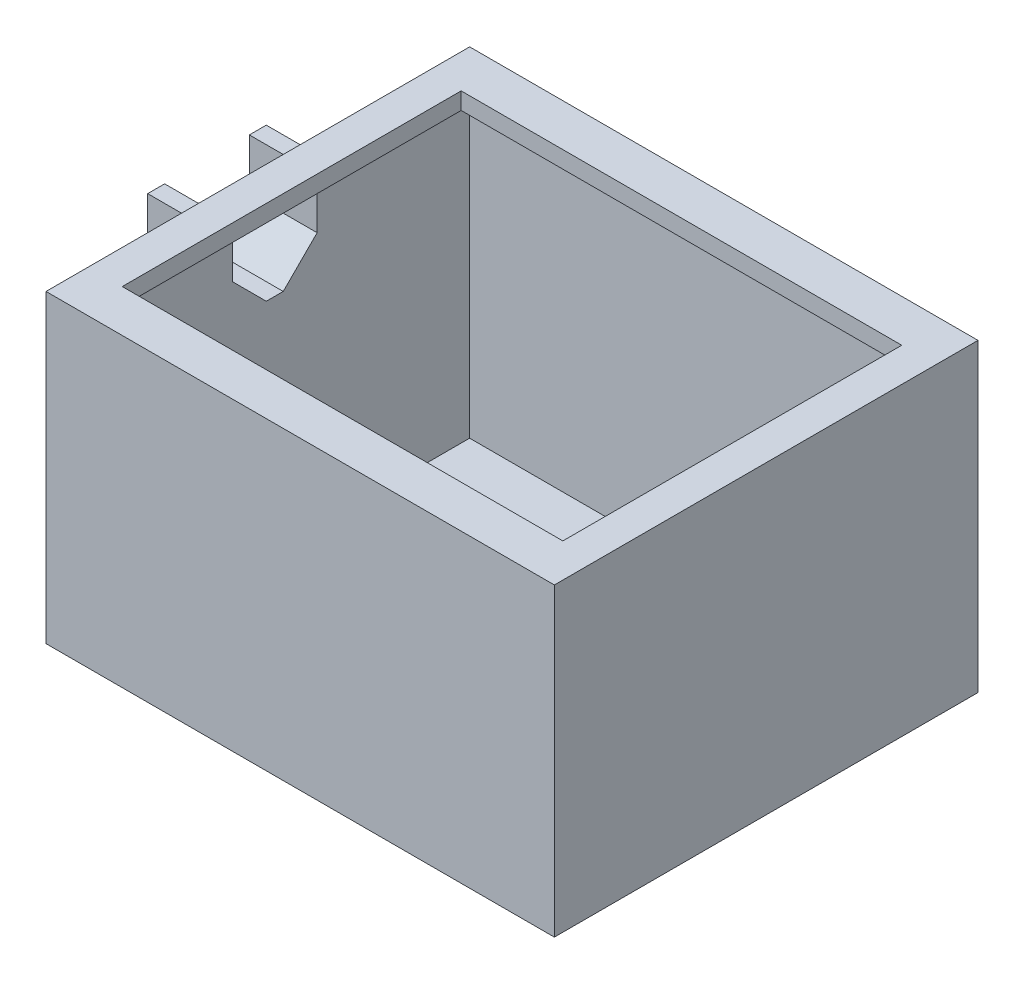
from build123d import *

# Parameters (mm, degrees)
SKETCH1_W           = 60
SKETCH1_H           = 50
BOSS_EXTRUDE1_DEPTH = 40
SHELL1_T            = 2
SKETCH2_W           = 52
SKETCH2_H           = 40
CUT_EXTRUDE1_DEPTH  = 10
CHAMFER1_SIZE       = 4
SKETCH3_W           = 10
SKETCH3_H           = 10
CUT_EXTRUDE2_DEPTH  = 5
BOSS_EXTRUDE2_DEPTH = 6
CHAMFER3_SIZE       = 5
CHAMFER4_SIZE       = 4


with BuildPart() as part:
    # Sketch1 → Boss-Extrude1 (new body)
    with BuildSketch(Plane(origin=(0, 0, 0), x_dir=(1, 0, 0), z_dir=(0, 1, 0))):
        Rectangle(SKETCH1_W, SKETCH1_H)
    extrude(amount=BOSS_EXTRUDE1_DEPTH)

    # Shell1 (no face opened: a closed hollow body)
    add(offset(amount=-SHELL1_T, mode=Mode.PRIVATE), mode=Mode.SUBTRACT)

    # Sketch2 → Cut-Extrude1 (cut)
    with BuildSketch(Plane(origin=(0, 40, 0), x_dir=(1, 0, 0), z_dir=(0, 1, 0))):
        Rectangle(SKETCH2_W, SKETCH2_H)
    extrude(amount=-CUT_EXTRUDE1_DEPTH, mode=Mode.SUBTRACT)

    # Chamfer1
    chamfer1_edges = [part.edges().sort_by_distance(p)[0] for p in [
        (0, 0, 25),
        (-30, 0, 0),
        (0, 0, -25),
        (30, 0, 0),
    ]]
    chamfer(chamfer1_edges, length=CHAMFER1_SIZE)

    # Sketch3 → Cut-Extrude2 (cut)
    with BuildSketch(Plane(origin=(-30, 0, 0), x_dir=(0, 0, -1), z_dir=(1, 0, 0))):
        with Locations((0, 33)):
            Rectangle(SKETCH3_W, SKETCH3_H)
    extrude(amount=CUT_EXTRUDE2_DEPTH, mode=Mode.SUBTRACT)

    # Sketch4 → Boss-Extrude2 (add)
    with BuildSketch(Plane(origin=(-30, 0, 0), x_dir=(0, 0, -1), z_dir=(1, 0, 0))):
        Polygon((-5, 38), (-7, 38), (-7, 26), (7, 26), (7, 38), (5, 38), (5, 28), (-5, 28), align=None)
    extrude(amount=-BOSS_EXTRUDE2_DEPTH)

    # Chamfer3
    chamfer3_edges = [part.edges().sort_by_distance(p)[0] for p in [
        (-30, 26, 0),
    ]]
    chamfer(chamfer3_edges, length=CHAMFER3_SIZE)

    # Chamfer4
    chamfer4_edges = [part.edges().sort_by_distance(p)[0] for p in [
        (-32, 28, 5),
        (-32, 28, -5),
    ]]
    chamfer(chamfer4_edges, length=CHAMFER4_SIZE)


solid = part.part
